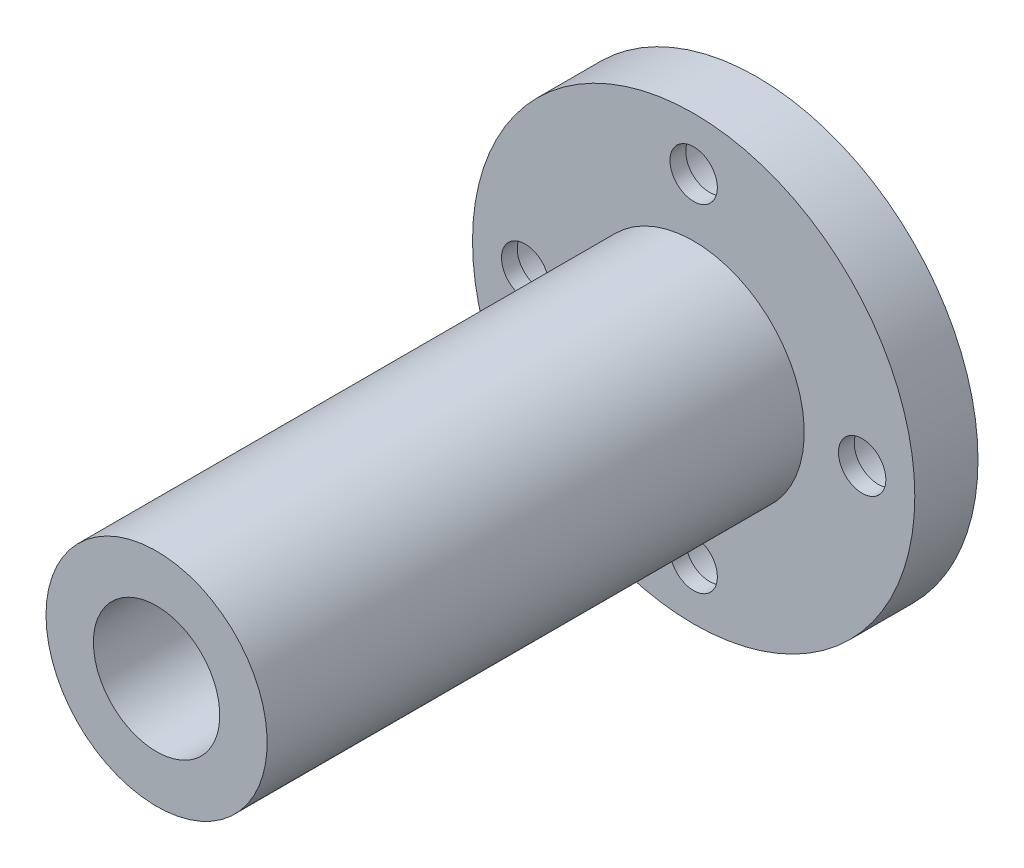
from build123d import *

# Parameters (mm, degrees)
CROQUIS6_R            = 2.25
CORTAR_EXTRUIR3_DEPTH = 60.016946719
CROQUIS7_R            = 3.75
CORTAR_EXTRUIR4_DEPTH = 4.5


with BuildPart() as part:
    # Croquis5 → Revolución1 (revolve)
    with BuildSketch(Plane(origin=(0, 0, 0), x_dir=(0, 0, -1), z_dir=(1, 0, 0)), mode=Mode.PRIVATE) as revoluci_n1_sk:
        Polygon((0, 6), (-57, 6), (-57, 10.5), (-6, 10.5), (-6, 21), (0, 21), align=None)
    revolve(revoluci_n1_sk.sketch.rotate(Axis((0, 0, 0), (0, 0, 1)), 90), axis=Axis((0, 0, 0), (0, 0, 1)))

    # Croquis6 → Cortar-Extruir3 (cut, through all)
    with BuildSketch(Plane.XY.offset(6)):
        with Locations((0, 16)):
            Circle(CROQUIS6_R)
        with Locations((16, 0)):
            Circle(CROQUIS6_R)
        with Locations((0, -16)):
            Circle(CROQUIS6_R)
        with Locations((-16, 0)):
            Circle(CROQUIS6_R)
    extrude(amount=-CORTAR_EXTRUIR3_DEPTH, mode=Mode.SUBTRACT)

    # Croquis7 → Cortar-Extruir4 (cut)
    with BuildSketch(Plane(origin=(0, 0, 0), x_dir=(-1, 0, 0), z_dir=(0, 0, -1))):
        with Locations((0, 16)):
            Circle(CROQUIS7_R)
        with Locations((16, 0)):
            Circle(CROQUIS7_R)
        with Locations((0, -16)):
            Circle(CROQUIS7_R)
        with Locations((-16, 0)):
            Circle(CROQUIS7_R)
    extrude(amount=-CORTAR_EXTRUIR4_DEPTH, mode=Mode.SUBTRACT)


solid = part.part
